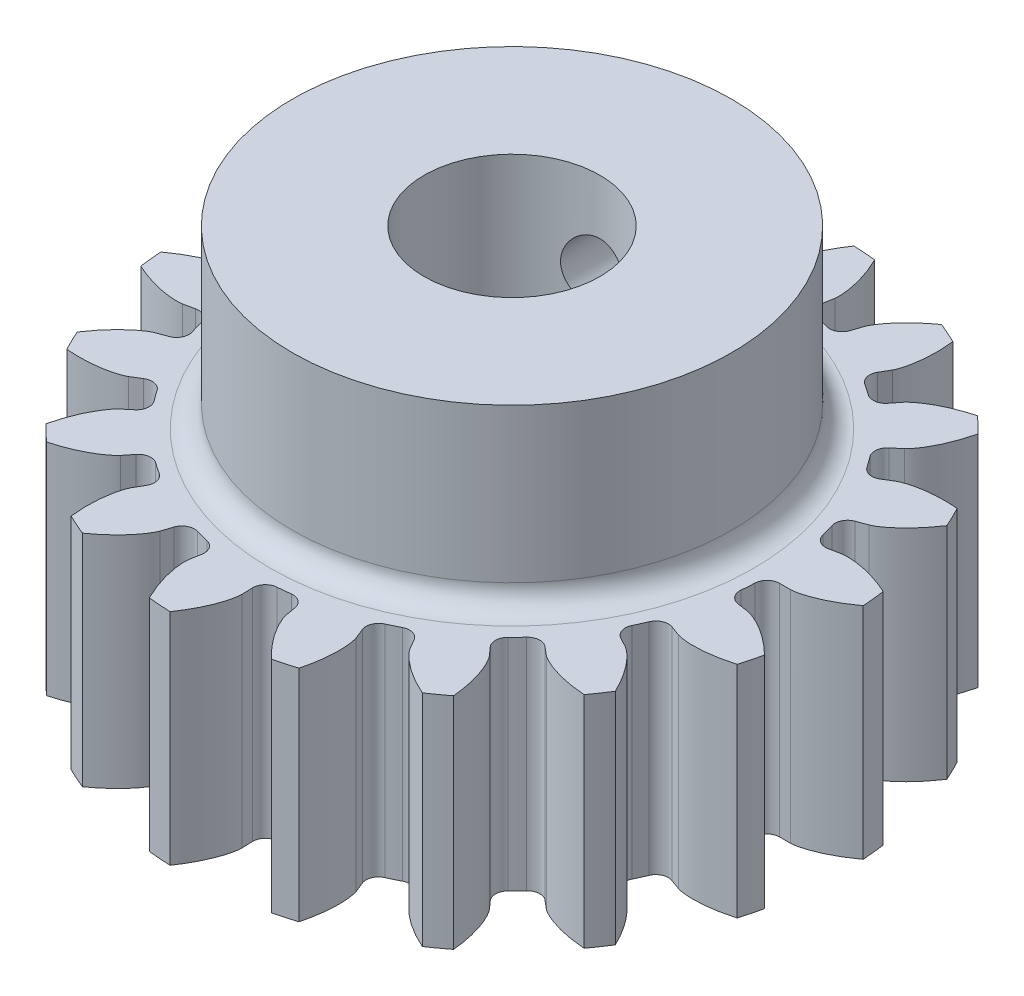
from build123d import *

# Parameters (mm, degrees)
ESQUISSE1_R                        = 15
BOSS_EXTRU_1_DEPTH                 = 10
ENL_V_MAT_EXTRU_1_DEPTH            = 24.452078799
CONG_1_R                           = 0.57
R_P_TITION_CIRCULAIRE1_COUNT       = 18
CONG_1_OF_R_P_TITION_CIRCULAIRE1_R = 0.57
ESQUISSE6_R                        = 4
ENL_V_MAT_EXTRU_2_DEPTH            = 24.422832699
BOSS_EXTRU_2_START                 = 8
ESQUISSE7_R                        = 10
ESQUISSE7_R_2                      = 4
BOSS_EXTRU_2_DEPTH                 = 8
CONG_2_R                           = 1
ESQUISSE8_R                        = 1.5
ENL_V_MAT_EXTRU_3_DEPTH            = 28.79620639


with BuildPart() as part:
    # Esquisse1 → Boss.-Extru.1 (new body)
    with BuildSketch(Plane(origin=(0, 0, 0), x_dir=(1, 0, 0), z_dir=(0, 1, 0))):
        with Locations(Location((0, 0, 0), (0, 0, 270))):
            Circle(ESQUISSE1_R)
    extrude(amount=BOSS_EXTRU_1_DEPTH)

    # Esquisse5 → Enlèv. mat.-Extru.1 (cut, symmetric)
    with BuildSketch(Plane(origin=(0, 0, 0), x_dir=(1, 0, 0), z_dir=(0, 1, 0))):
        with BuildLine():
            add(Edge.make_bspline(
                [(12.685850381, 0), (12.69522907, 0.00019847), (12.721513502, 0.001369319), (12.771095723, 0.006007086), (12.851667315, 0.017005792), (12.953705597, 0.036042512), (13.084625834, 0.066377448), (13.237381246, 0.10942845), (13.403418578, 0.164334622), (13.581780638, 0.232170805), (13.757479313, 0.30693713), (13.930450016, 0.388032644), (14.10054883, 0.474640612), (14.30376747, 0.58632283), (14.543374477, 0.72960052), (14.737348348, 0.85778235), (14.887738449, 0.9639137), (14.965016657, 1.020333489), (14.965245681, 1.020500713)],
                knots=[0, 0, 0, 0, 0, 0.005376748, 0.015083688, 0.02853182, 0.046610139, 0.064854849, 0.092110525, 0.119476175, 0.146842495, 0.174208853, 0.201574955, 0.228941013, 0.256307345, 0.307035032, 0.361767351, 0.361930045, 0.361930045, 0.361930045, 0.361930045, 0.361930045], degree=4))
            Line((12.685850381, 0), (11.625, 0))
            ThreePointArc((11.625, 0), (11.594577503, -0.840474584), (11.503469243, -1.676550143))
            Line((11.503469243, -1.676550143), (12.553229219, -1.829545313))
            add(Edge.make_bspline(
                [(12.553229219, -1.829545313), (12.562481238, -1.831094296), (12.588322027, -1.83604363), (12.636717046, -1.847783629), (12.714860096, -1.870287336), (12.813086179, -1.903840937), (12.938262857, -1.952739977), (13.083212536, -2.017371202), (13.239595538, -2.095649169), (13.406309664, -2.188499439), (13.569388787, -2.287823289), (13.728855665, -2.393016735), (13.884685677, -2.503250824), (14.069673077, -2.643073551), (14.286111753, -2.81940935), (14.459571469, -2.974225923), (14.593083156, -3.100936914), (14.661416652, -3.16791189), (14.661619164, -3.168110395)],
                knots=[0, 0, 0, 0, 0, 0.005376748, 0.015083688, 0.02853182, 0.046610139, 0.064854849, 0.092110525, 0.119476175, 0.146842495, 0.174208853, 0.201574955, 0.228941013, 0.256307345, 0.307035032, 0.361767351, 0.361930045, 0.361930045, 0.361930045, 0.361930045, 0.361930045], degree=4))
            ThreePointArc((14.661619164, -3.168110395), (14.915164891, -1.593065054), (15, 0))
            ThreePointArc((15, 0), (14.991308902, 0.51054617), (14.965245681, 1.020500713))
        make_face()
    enl_v_mat_extru_1 = extrude(amount=ENL_V_MAT_EXTRU_1_DEPTH, both=True, mode=Mode.SUBTRACT)

    # Congé1
    cong_1_edges = [part.edges().sort_by_distance(p)[0] for p in [
        (11.625, 5, 0),
        (11.503469243, 5, 1.676550143),
    ]]
    fillet(cong_1_edges, radius=CONG_1_R)

    # Répétition circulaire1: Enlèv. mat.-Extru.1 ×18 about axis
    r_p_tition_circulaire1_axis = Axis((0, 10, 0), (0, 1, 0))
    for i in range(1, R_P_TITION_CIRCULAIRE1_COUNT):
        add(enl_v_mat_extru_1.rotate(r_p_tition_circulaire1_axis, i * 360 / R_P_TITION_CIRCULAIRE1_COUNT), mode=Mode.SUBTRACT)

    # Congé1 of Répétition circulaire1
    cong_1_of_r_p_tition_circulaire1_edges = [part.edges().sort_by_distance(p)[0] for p in [
        (10.923926717, 5, -3.975984166),
        (11.383139081, 5, -2.358976402),
        (8.905266651, 5, -7.472405963),
        (9.889834349, 5, -6.109975577),
        (5.8125, 5, -10.067545319),
        (7.203669636, 5, -9.124021525),
        (2.018660065, 5, -11.448390129),
        (3.64863605, 5, -11.03757582),
        (-2.018660065, 5, -11.448390129),
        (-0.346476892, 5, -11.619835574),
        (-5.8125, 5, -10.067545319),
        (-4.299799607, 5, -10.800571667),
        (-8.905266651, 5, -7.472405963),
        (-7.734503031, 5, -8.678599418),
        (-10.923926717, 5, -3.975984166),
        (-10.236311241, 5, -5.509859997),
        (-11.625, 5, 0),
        (-11.503469243, 5, -1.676550143),
        (-10.923926717, 5, 3.975984166),
        (-11.383139081, 5, 2.358976402),
        (-8.905266651, 5, 7.472405963),
        (-9.889834349, 5, 6.109975577),
        (-5.8125, 5, 10.067545319),
        (-7.203669636, 5, 9.124021525),
        (-2.018660065, 5, 11.448390129),
        (-3.64863605, 5, 11.03757582),
        (2.018660065, 5, 11.448390129),
        (0.346476892, 5, 11.619835574),
        (5.8125, 5, 10.067545319),
        (4.299799607, 5, 10.800571667),
        (8.905266651, 5, 7.472405963),
        (7.734503031, 5, 8.678599418),
        (10.923926717, 5, 3.975984166),
        (10.236311241, 5, 5.509859997),
    ]]
    fillet(cong_1_of_r_p_tition_circulaire1_edges, radius=CONG_1_OF_R_P_TITION_CIRCULAIRE1_R)

    # Esquisse6 → Enlèv. mat.-Extru.2 (cut, through all)
    with BuildSketch(Plane(origin=(0, 10, 0), x_dir=(1, 0, 0), z_dir=(0, 1, 0))):
        with Locations(Location((0, 0, 0), (0, 0, 270))):
            Circle(ESQUISSE6_R)
    extrude(amount=-ENL_V_MAT_EXTRU_2_DEPTH, mode=Mode.SUBTRACT)

    # Esquisse7 → Boss.-Extru.2 (add)
    with BuildSketch(Plane(origin=(0, 10, 0), x_dir=(1, 0, 0), z_dir=(0, 1, 0)).offset(BOSS_EXTRU_2_START)):
        with Locations(Location((0, 0, 0), (0, 0, 270))):
            Circle(ESQUISSE7_R)
        with Locations(Location((0, 0, 0), (0, 0, 270))):
            Circle(ESQUISSE7_R_2, mode=Mode.SUBTRACT)
    extrude(amount=-BOSS_EXTRU_2_DEPTH)

    # Congé2
    cong_2_edges = [part.edges().sort_by_distance(p)[0] for p in [
        (0, 10, -10),
    ]]
    fillet(cong_2_edges, radius=CONG_2_R)

    # Esquisse8 → Enlèv. mat.-Extru.3 (cut, through all)
    with BuildSketch(Plane.XY):
        with Locations((0, 14)):
            Circle(ESQUISSE8_R)
    extrude(amount=-ENL_V_MAT_EXTRU_3_DEPTH, mode=Mode.SUBTRACT)


solid = part.part
